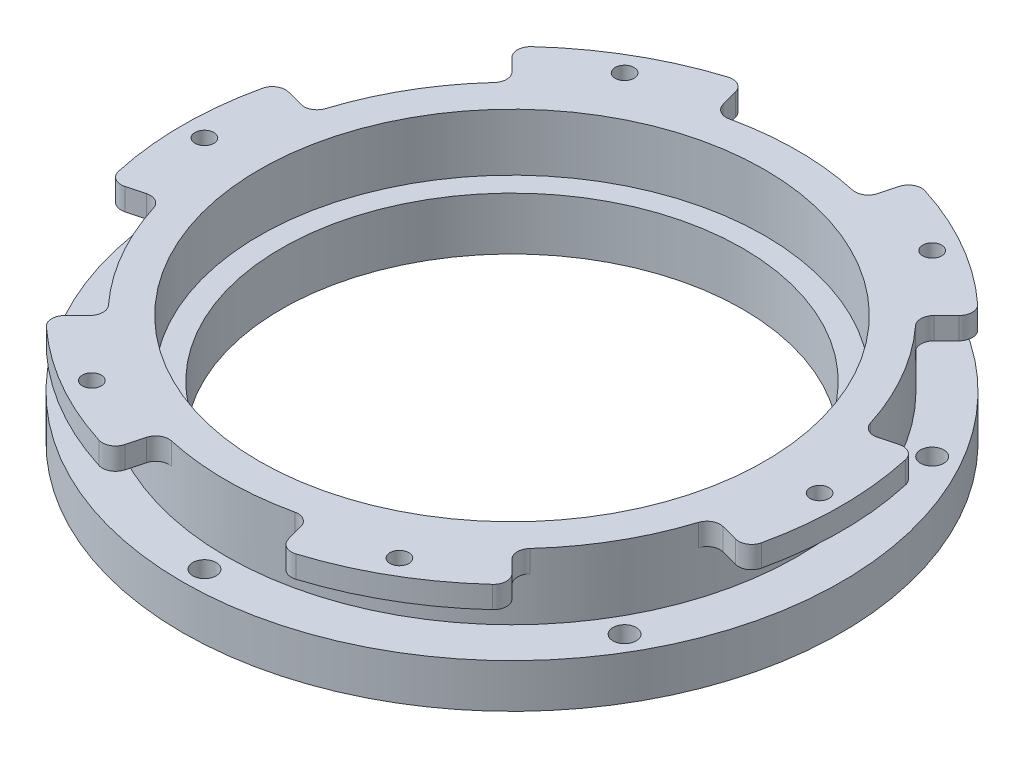
from build123d import *

# Parameters (mm, degrees)
SKETCH_1_R               = 75
SKETCH_1_R_2             = 2.65
EXTRUDE_1_DEPTH          = 10
SKETCH_2_R               = 65
SKETCH_2_R_2             = 52.5
EXTRUDE_2_DEPTH          = 2
SKETCH_3_R               = 65
SKETCH_3_R_2             = 57.5
EXTRUDE_3_DEPTH          = 13
EXTRUDE_START            = -5
SKETCH_4_R               = 2.15
EXTRUDE_4_DEPTH          = 5
PATTERN_CIRCULAR_1_COUNT = 6
FILLET_1_R               = 3
CUT_EXTRUDE_START        = -80
SKETCH_6_R               = 52.5
CUT_EXTRUDE_1_DEPTH      = 80


with BuildPart() as part:
    # 草图1 → 凸台-拉伸1 (new body)
    with BuildSketch(Plane(origin=(0, 0, 0), x_dir=(1, 0, 0), z_dir=(0, 1, 0))):
        with Locations(Location((0, 0, 0), (0, 0, 270))):
            Circle(SKETCH_1_R)
        with Locations(Location((0, 70, 0), (0, 0, 270))):
            Circle(SKETCH_1_R_2, mode=Mode.SUBTRACT)
        with Locations(Location((60.621778265, 35, 0), (0, 0, 270))):
            Circle(SKETCH_1_R_2, mode=Mode.SUBTRACT)
        with Locations(Location((60.621778265, -35, 0), (0, 0, 270))):
            Circle(SKETCH_1_R_2, mode=Mode.SUBTRACT)
        with Locations(Location((0, -70, 0), (0, 0, 270))):
            Circle(SKETCH_1_R_2, mode=Mode.SUBTRACT)
        with Locations(Location((-60.621778265, -35, 0), (0, 0, 270))):
            Circle(SKETCH_1_R_2, mode=Mode.SUBTRACT)
        with Locations(Location((-60.621778265, 35, 0), (0, 0, 270))):
            Circle(SKETCH_1_R_2, mode=Mode.SUBTRACT)
    extrude(amount=EXTRUDE_1_DEPTH)

    # 草图2 → 凸台-拉伸2 (add)
    with BuildSketch(Plane(origin=(0, 10, 0), x_dir=(1, 0, 0), z_dir=(0, 1, 0))):
        with Locations(Location((0, 0, 0), (0, 0, 270))):
            Circle(SKETCH_2_R)
        with Locations(Location((0, 0, 0), (0, 0, 270))):
            Circle(SKETCH_2_R_2, mode=Mode.SUBTRACT)
    extrude(amount=EXTRUDE_2_DEPTH)

    # 草图3 → 凸台-拉伸3 (add)
    with BuildSketch(Plane(origin=(0, 12, 0), x_dir=(1, 0, 0), z_dir=(0, 1, 0))):
        with Locations(Location((0, 0, 0), (0, 0, 270))):
            Circle(SKETCH_3_R)
        with Locations(Location((0, 0, 0), (0, 0, 90))):
            Circle(SKETCH_3_R_2, mode=Mode.SUBTRACT)
    extrude(amount=EXTRUDE_3_DEPTH)

    # 草图4 → 凸台-拉伸4 (add)
    with BuildSketch(Plane(origin=(0, 25, 0), x_dir=(1, 0, 0), z_dir=(0, 1, 0)).offset(EXTRUDE_START)):
        with BuildLine():
            Line((-53.033008589, 53.033008589), (-45.961940777, 45.961940777))
            ThreePointArc((-45.961940777, 45.961940777), (-32.5, 56.291651246), (-16.823237932, 62.785178709))
            Line((-16.823237932, 62.785178709), (-19.411428383, 72.444436972))
            ThreePointArc((-19.411428383, 72.444436972), (-37.5, 64.951905284), (-53.033008589, 53.033008589))
        make_face()
        with Locations(Location((-35, 60.621778265, 0), (0, 0, 270))):
            Circle(SKETCH_4_R, mode=Mode.SUBTRACT)
    extrude_4 = extrude(amount=EXTRUDE_4_DEPTH)

    # 阵列(圆周)1: 凸台-拉伸4 ×6 about axis
    pattern_circular_1_axis = Axis((0, 0, 0), (0, 1, 0))
    for i in range(1, PATTERN_CIRCULAR_1_COUNT):
        add(extrude_4.rotate(pattern_circular_1_axis, i * 360 / PATTERN_CIRCULAR_1_COUNT))

    # 圆角1
    fillet_1_edges = [part.edges().sort_by_distance(p)[0] for p in [
        (62.785178709, 22.5, -16.823237932),
        (72.444436972, 22.5, -19.411428383),
        (72.444436972, 22.5, 19.411428383),
        (45.961940777, 22.5, -45.961940777),
        (16.823237932, 22.5, -62.785178709),
        (19.411428383, 22.5, -72.444436972),
        (53.033008589, 22.5, -53.033008589),
        (-16.823237932, 22.5, -62.785178709),
        (-45.961940777, 22.5, -45.961940777),
        (-53.033008589, 22.5, -53.033008589),
        (-19.411428383, 22.5, -72.444436972),
        (-62.785178709, 22.5, -16.823237932),
        (-62.785178709, 22.5, 16.823237932),
        (-72.444436972, 22.5, 19.411428383),
        (-72.444436972, 22.5, -19.411428383),
        (-45.961940777, 22.5, 45.961940777),
        (-16.823237932, 22.5, 62.785178709),
        (-19.411428383, 22.5, 72.444436972),
        (-53.033008589, 22.5, 53.033008589),
        (16.823237932, 22.5, 62.785178709),
        (45.961940777, 22.5, 45.961940777),
        (53.033008589, 22.5, 53.033008589),
        (19.411428383, 22.5, 72.444436972),
        (62.785178709, 22.5, 16.823237932),
    ]]
    fillet(fillet_1_edges, radius=FILLET_1_R)

    # 草图6 → 切除-拉伸1 (cut)
    with BuildSketch(Plane(origin=(0, 10, 0), x_dir=(1, 0, 0), z_dir=(0, 1, 0)).offset(CUT_EXTRUDE_START)):
        with Locations(Location((0, 0, 0), (0, 0, 270))):
            Circle(SKETCH_6_R)
    extrude(amount=CUT_EXTRUDE_1_DEPTH, mode=Mode.SUBTRACT)


solid = part.part
